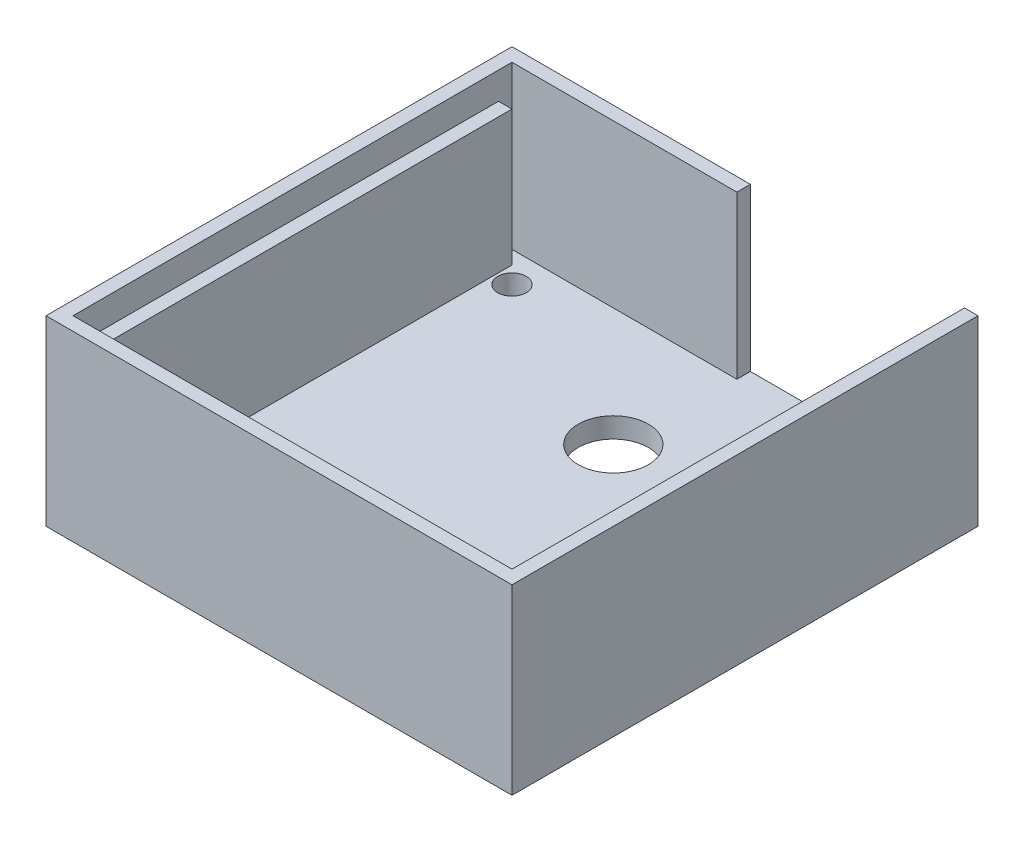
from build123d import *

# Parameters (mm, degrees)
SKETCH_1_W          = 34.5
SKETCH_1_H          = 34.5
EXTRUDE_1_DEPTH     = 13.5
SKETCH_2_W          = 32.5
SKETCH_2_H          = 32.5
CUT_EXTRUDE_1_DEPTH = 2
SKETCH_3_W          = 30.5
SKETCH_3_H          = 30.5
CUT_EXTRUDE_2_DEPTH = 10
SKETCH_4_R          = 1.055259324
SKETCH_4_R_2        = 2.6
CUT_EXTRUDE_3_DEPTH = 12
CUT_EXTRUDE_4_REACH = 52.624
SKETCH_5_W          = 15.85
SKETCH_5_H          = 2.015973822
SKETCH_7_W          = 16.65
SKETCH_7_H          = 1
CUT_EXTRUDE_6_DEPTH = 10
SKETCH_8_W          = 9.5
SKETCH_8_H          = 1
CUT_EXTRUDE_7_DEPTH = 10


with BuildPart() as part:
    # 草图1 → 凸台-拉伸1 (new body)
    with BuildSketch(Plane(origin=(0, 0, 0), x_dir=(1, 0, 0), z_dir=(0, 1, 0))):
        with Locations((17.25, 17.25)):
            Rectangle(SKETCH_1_W, SKETCH_1_H)
    extrude(amount=EXTRUDE_1_DEPTH)

    # 草图2 → 切除-拉伸1 (cut)
    with BuildSketch(Plane(origin=(0, 13.5, 0), x_dir=(1, 0, 0), z_dir=(0, 1, 0))):
        with Locations((17.25, 17.25)):
            Rectangle(SKETCH_2_W, SKETCH_2_H)
    extrude(amount=-CUT_EXTRUDE_1_DEPTH, mode=Mode.SUBTRACT)

    # 草图3 → 切除-拉伸2 (cut)
    with BuildSketch(Plane(origin=(0, 11.5, 0), x_dir=(1, 0, 0), z_dir=(0, 1, 0))):
        with Locations((17.25, 17.25)):
            Rectangle(SKETCH_3_W, SKETCH_3_H)
    extrude(amount=-CUT_EXTRUDE_2_DEPTH, mode=Mode.SUBTRACT)

    # 草图4 → 切除-拉伸3 (cut)
    with BuildSketch(Plane(origin=(0, 1.5, 0), x_dir=(1, 0, 0), z_dir=(0, 1, 0))):
        with Locations(Location((3.25, 31.25, 0), (0, 0, 270))):
            Circle(SKETCH_4_R)
        with Locations(Location((31.25, 31.25, 0), (0, 0, 90))):
            Circle(SKETCH_4_R)
        with Locations(Location((31.25, 3.25, 0), (0, 0, 270))):
            Circle(SKETCH_4_R)
        with Locations(Location((3.25, 3.25, 0), (0, 0, 90))):
            Circle(SKETCH_4_R)
        with Locations(Location((17.25, 24.75, 0), (0, 0, 270))):
            Circle(SKETCH_4_R_2)
        with Locations(Location((17.25, 9.75, 0), (0, 0, 90))):
            Circle(SKETCH_4_R_2)
    extrude(amount=-CUT_EXTRUDE_3_DEPTH, mode=Mode.SUBTRACT)

    # 切除-拉伸4: up to this face of the body (flat: up to its plane)
    cut_extrude_4_end = Plane(part.part.faces().sort_by_distance((17.25, 1.5, -17.25))[0])
    # 草图5 → 切除-拉伸4 (cut, up to the picked face)
    with BuildSketch(Plane(origin=(0, 13.5, 0), x_dir=(1, 0, 0), z_dir=(0, 1, 0)), mode=Mode.PRIVATE) as cut_extrude_4_sk1:
        with Locations((25.575, 33.492013089)):
            Rectangle(SKETCH_5_W, SKETCH_5_H)
    cut_extrude_4_tool1 = split(extrude(cut_extrude_4_sk1.sketch, amount=-CUT_EXTRUDE_4_REACH, mode=Mode.PRIVATE), bisect_by=cut_extrude_4_end, keep=Keep.BOTH, mode=Mode.PRIVATE)
    add(cut_extrude_4_tool1.solids().sort_by(Axis((25.575, 13.5, -33.492013), (0, -1, 0)))[0], mode=Mode.SUBTRACT)

    # 草图7 → 切除-拉伸6 (cut)
    with BuildSketch(Plane(origin=(0, 11.5, 0), x_dir=(1, 0, 0), z_dir=(0, 1, 0))):
        with Locations((9.325, 33)):
            Rectangle(SKETCH_7_W, SKETCH_7_H)
    extrude(amount=-CUT_EXTRUDE_6_DEPTH, mode=Mode.SUBTRACT)

    # 草图8 → 切除-拉伸7 (cut)
    with BuildSketch(Plane(origin=(0, 11.5, 0), x_dir=(1, 0, 0), z_dir=(0, 1, 0))):
        with Locations((9.75, 1.5)):
            Rectangle(SKETCH_8_W, SKETCH_8_H)
    extrude(amount=-CUT_EXTRUDE_7_DEPTH, mode=Mode.SUBTRACT)


solid = part.part
